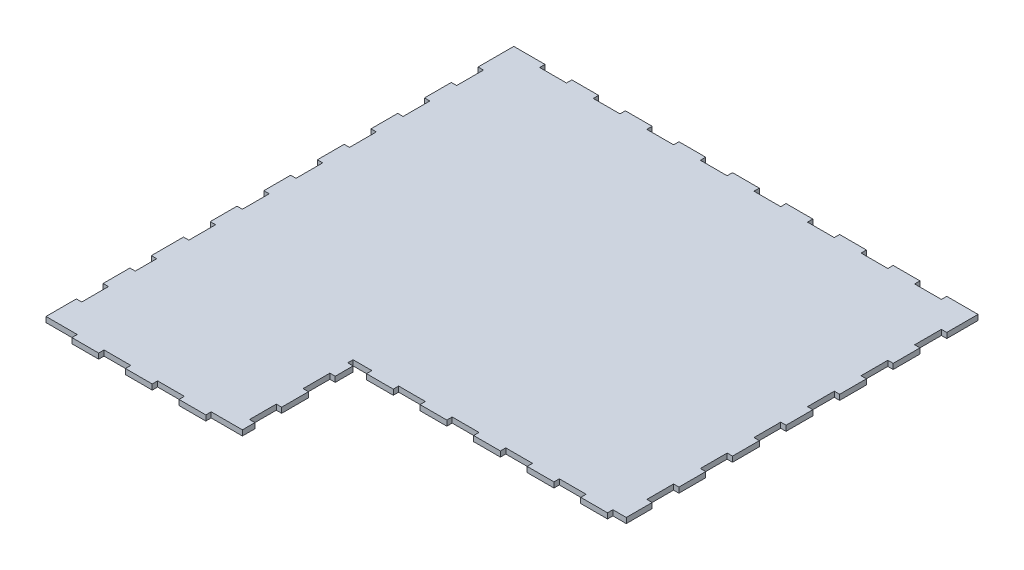
from build123d import *

# Parameters (mm, degrees)
SALIENTE_EXTRUIR1_DEPTH = 3


with BuildPart() as part:
    # Croquis1 → Saliente-Extruir1 (new body)
    with BuildSketch(Plane(origin=(0, 0, 0), x_dir=(1, 0, 0), z_dir=(0, 1, 0))):
        Polygon((17.5, 0), (32.5, 0), (32.5, 3), (47.5, 3), (47.5, 0), (62.5, 0), (62.5, 3), (77.5, 3), (77.5, 0), (92.5, 0), (92.5, 3), (110, 3), (110, 10), (107, 10), (107, 25), (110, 25), (110, 40), (107, 40), (107, 55), (110, 55), (110, 65), (107, 65), (107, 68), (117.5, 68), (117.5, 65), (132.5, 65), (132.5, 68), (147.5, 68), (147.5, 65), (162.5, 65), (162.5, 68), (177.5, 68), (177.5, 65), (192.5, 65), (192.5, 68), (207.5, 68), (207.5, 65), (222.5, 65), (222.5, 68), (237.5, 68), (237.5, 65), (252.5, 65), (252.5, 68), (260, 68), (260, 82.5), (257, 82.5), (257, 97.5), (260, 97.5), (260, 112.5), (257, 112.5), (257, 127.5), (260, 127.5), (260, 142.5), (257, 142.5), (257, 157.5), (260, 157.5), (260, 172.5), (257, 172.5), (257, 187.5), (260, 187.5), (260, 202.5), (257, 202.5), (257, 217.5), (260, 217.5), (260, 232.5), (257, 232.5), (257, 247.5), (260, 247.5), (260, 265), (242.5, 265), (242.5, 262), (227.5, 262), (227.5, 265), (212.5, 265), (212.5, 262), (197.5, 262), (197.5, 265), (182.5, 265), (182.5, 262), (167.5, 262), (167.5, 265), (152.5, 265), (152.5, 262), (137.5, 262), (137.5, 265), (122.5, 265), (122.5, 262), (107.5, 262), (107.5, 265), (92.5, 265), (92.5, 262), (77.5, 262), (77.5, 265), (62.5, 265), (62.5, 262), (47.5, 262), (47.5, 265), (32.5, 265), (32.5, 262), (17.5, 262), (17.5, 265), (0, 265), (0, 245), (3, 245), (3, 230), (0, 230), (0, 215), (3, 215), (3, 200), (0, 200), (0, 185), (3, 185), (3, 170), (0, 170), (0, 155), (3, 155), (3, 140), (0, 140), (0, 125), (3, 125), (3, 110), (0, 110), (0, 95), (3, 95), (3, 80), (0, 80), (0, 62), (3, 62), (3, 50), (0, 50), (0, 35), (3, 35), (3, 20), (0, 20), (0, 3), (17.5, 3), align=None)
    extrude(amount=SALIENTE_EXTRUIR1_DEPTH)


solid = part.part
